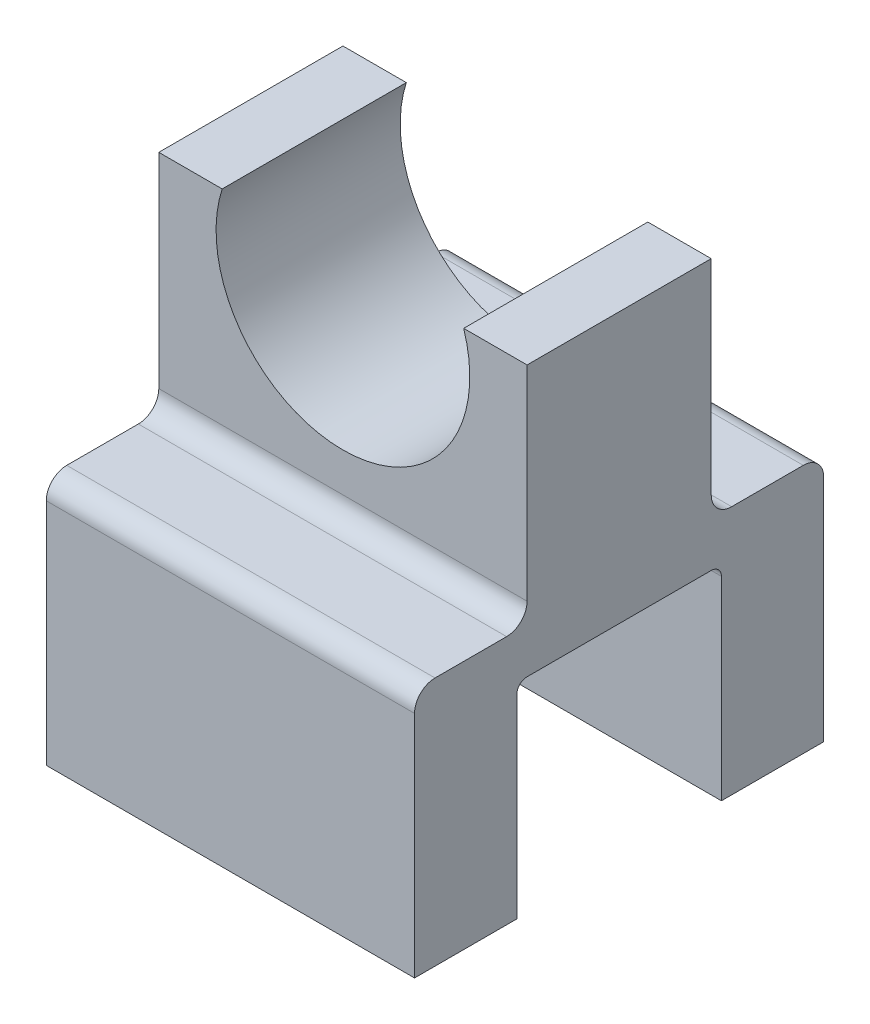
from build123d import *

# Parameters (mm, degrees)
BOSS_EXTRUDE1_DEPTH = 50.8
SKETCH2_W           = 25.4
SKETCH2_H           = 25.4
CUT_EXTRUDE1_DEPTH  = 91.241163468
FILLET1_R           = 1.27
SKETCH4_W           = 13.97
SKETCH4_H           = 27.94
CUT_EXTRUDE2_DEPTH  = 91.241163468
FILLET2_R           = 2.54


with BuildPart() as part:
    # Sketch1 → Boss-Extrude1 (new body)
    with BuildSketch(Plane.XY):
        with BuildLine():
            Line((37.850304467, 58.928), (45.72, 58.928))
            Line((45.72, 58.928), (45.72, 0))
            Line((45.72, 0), (0, 0))
            Line((0, 0), (0, 58.928))
            Line((0, 58.928), (7.869695533, 58.928))
            ThreePointArc((7.869695533, 58.928), (22.86, 38.354), (37.850304467, 58.928))
        make_face()
    extrude(amount=BOSS_EXTRUDE1_DEPTH)

    # Sketch2 → Cut-Extrude1 (cut, through all)
    with BuildSketch(Plane(origin=(45.72, 0, 0), x_dir=(0, 0, -1), z_dir=(1, 0, 0))):
        with Locations((-25.4, 12.7)):
            Rectangle(SKETCH2_W, SKETCH2_H)
    extrude(amount=-CUT_EXTRUDE1_DEPTH, mode=Mode.SUBTRACT)

    # Fillet1
    fillet1_edges = [part.edges().sort_by_distance(p)[0] for p in [
        (22.86, 25.4, 38.1),
        (22.86, 25.4, 12.7),
    ]]
    fillet(fillet1_edges, radius=FILLET1_R)

    # Sketch4 → Cut-Extrude2 (cut, through all)
    with BuildSketch(Plane.ZY):
        with Locations((43.815, 44.958)):
            Rectangle(SKETCH4_W, SKETCH4_H)
        with Locations((6.985, 44.958)):
            Rectangle(SKETCH4_W, SKETCH4_H)
    extrude(amount=-CUT_EXTRUDE2_DEPTH, mode=Mode.SUBTRACT)

    # Fillet2
    fillet2_edges = [part.edges().sort_by_distance(p)[0] for p in [
        (22.86, 30.988, 36.83),
        (22.86, 30.988, 50.8),
        (22.86, 30.988, 0),
        (22.86, 30.988, 13.97),
    ]]
    fillet(fillet2_edges, radius=FILLET2_R)


solid = part.part
